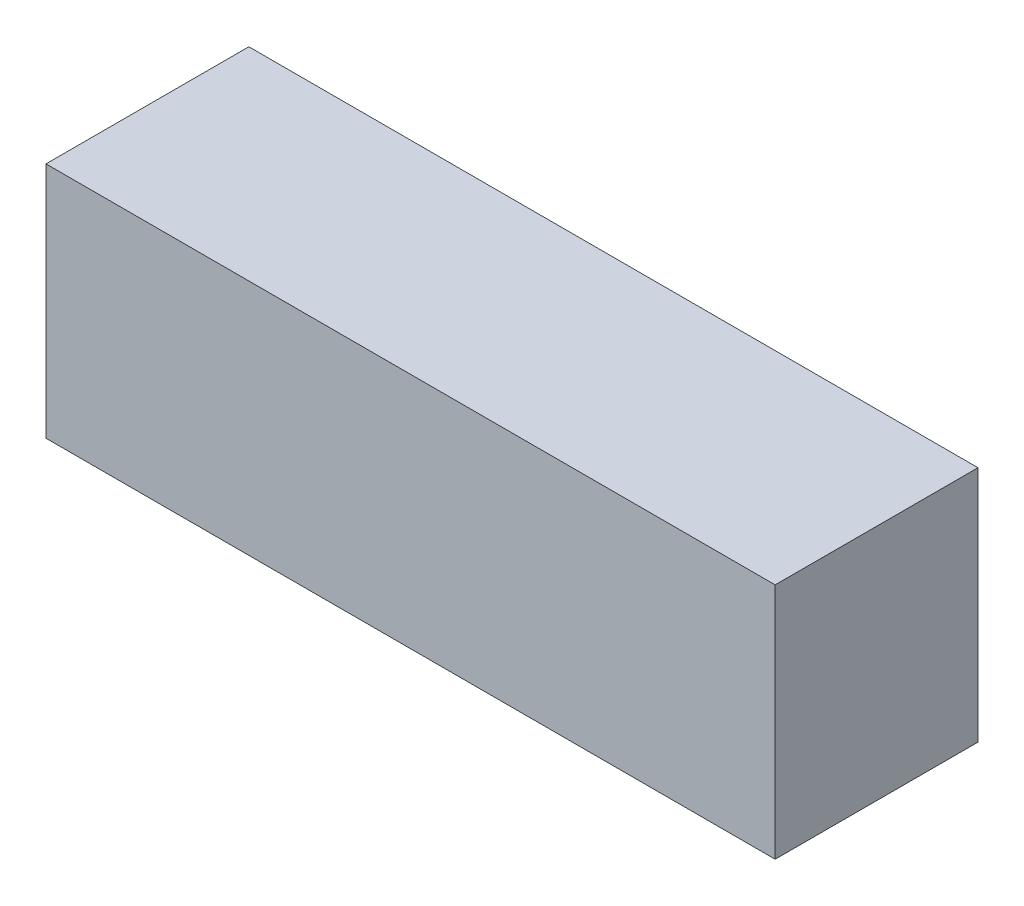
from build123d import *

# Parameters (mm, degrees)
BLOCK_PROFILE_W       = 71.8566
BLOCK_PROFILE_H       = 19.9898
EXTRUDE_PROFILE_DEPTH = 23.4188


with BuildPart() as part:
    # Block Profile → Extrude Profile (new body)
    with BuildSketch(Plane(origin=(0, 0, 0), x_dir=(1, 0, 0), z_dir=(0, 1, 0))):
        with Locations((35.9283, 9.9949)):
            Rectangle(BLOCK_PROFILE_W, BLOCK_PROFILE_H)
    extrude(amount=EXTRUDE_PROFILE_DEPTH)


solid = part.part
